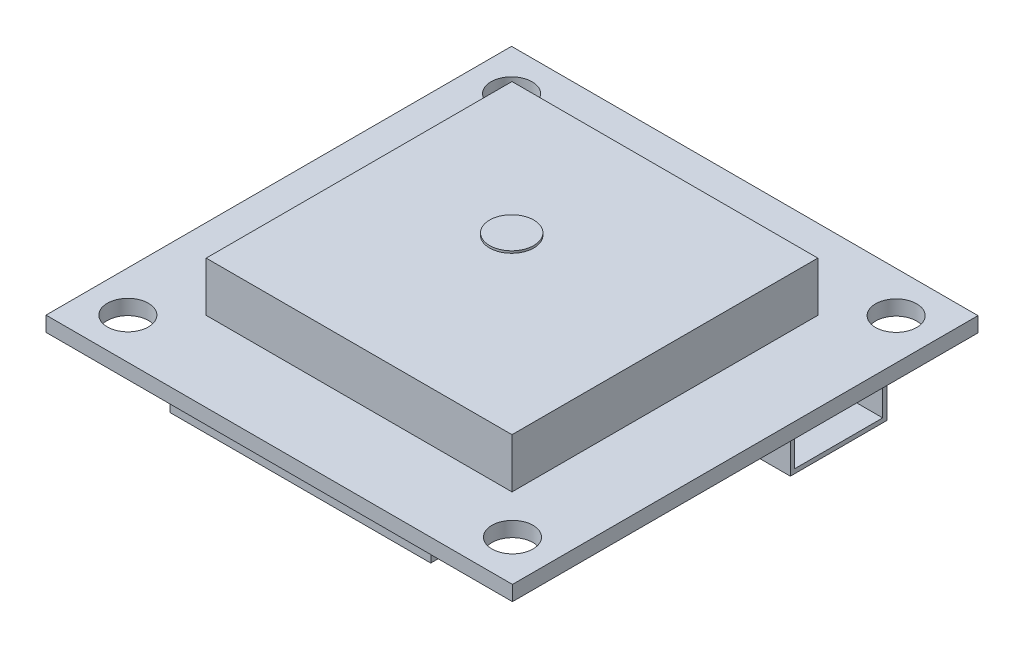
from build123d import *

# Parameters (mm, degrees)
SKETCH1_W           = 38.354
SKETCH1_H           = 38.2778
BOARD_DEPTH         = 1.2319
SKETCH3_W           = 25.146
SKETCH3_H           = 25.146
GPS_DEPTH           = 4.0767
SKETCH5_W           = 21.4376
SKETCH5_H           = 16.7894
UBLOCK_CHIP_DEPTH   = 2.4257
SKETCH6_R           = 3.3782
BATTERY_DEPTH       = 2.1082
SKETCH7_W           = 4.318
SKETCH7_H           = 7.9502
CONNECTOR_DEPTH     = 2.9972
SKETCH8_W           = 7.239
SKETCH8_H           = 2.286
CUT_EXTRUDE1_DEPTH  = 3.7592
CUT_EXTRUDE2_REACH  = 56.352
SKETCH9_R           = 1.6891
SKETCH10_R          = 1.8161
BOSS_EXTRUDE6_DEPTH = 0.1778
SKETCH11_W          = 22.479
SKETCH11_H          = 17.1323
BOSS_EXTRUDE7_DEPTH = 0.762


with BuildPart() as part:
    # Sketch1 → Board (new body)
    with BuildSketch(Plane(origin=(0, 0, 0), x_dir=(1, 0, 0), z_dir=(0, 1, 0))):
        with Locations((19.177, 19.1389)):
            Rectangle(SKETCH1_W, SKETCH1_H)
    extrude(amount=BOARD_DEPTH)

    # Sketch3 → GPS (add)
    with BuildSketch(Plane(origin=(0, 1.2319, 0), x_dir=(1, 0, 0), z_dir=(0, 1, 0))):
        with Locations((19.177, 19.1389)):
            Rectangle(SKETCH3_W, SKETCH3_H)
    extrude(amount=GPS_DEPTH)

    # Sketch5 → uBlock chip (add)
    with BuildSketch(Plane.XZ):
        with Locations((19.1008, -10.2108)):
            Rectangle(SKETCH5_W, SKETCH5_H)
    extrude(amount=UBLOCK_CHIP_DEPTH)

    # Sketch6 → Battery (add)
    with BuildSketch(Plane(origin=(0, 0, 0), x_dir=(-1, 0, 0), z_dir=(0, -1, 0))):
        with Locations(Location((-22.2758, 32.6263, 0), (0, 0, 90))):
            Circle(SKETCH6_R)
    extrude(amount=BATTERY_DEPTH)

    # Sketch7 → Connector (add)
    with BuildSketch(Plane(origin=(0, 0, 0), x_dir=(-1, 0, 0), z_dir=(0, -1, 0))):
        with Locations((-35.687, 27.3304)):
            Rectangle(SKETCH7_W, SKETCH7_H)
    extrude(amount=CONNECTOR_DEPTH)

    # Sketch8 → Cut-Extrude1 (cut)
    with BuildSketch(Plane(origin=(37.846, 0, 0), x_dir=(0, 0, -1), z_dir=(1, 0, 0))):
        with Locations((27.3304, -1.4986)):
            Rectangle(SKETCH8_W, SKETCH8_H)
    extrude(amount=-CUT_EXTRUDE1_DEPTH, mode=Mode.SUBTRACT)

    # Sketch9 → Cut-Extrude2 (cut, up to next)
    with BuildSketch(Plane(origin=(0, 1.2319, 0), x_dir=(1, 0, 0), z_dir=(0, 1, 0)), mode=Mode.PRIVATE) as cut_extrude2_sk1:
        with Locations(Location((34.9885, 3.3655, 0), (0, 0, 270))):
            Circle(SKETCH9_R)
    cut_extrude2_tool1 = extrude(cut_extrude2_sk1.sketch, amount=-CUT_EXTRUDE2_REACH, mode=Mode.PRIVATE) & part.part
    # Sketch9 → Cut-Extrude2 (cut, up to next)
    with BuildSketch(Plane(origin=(0, 1.2319, 0), x_dir=(1, 0, 0), z_dir=(0, 1, 0)), mode=Mode.PRIVATE) as cut_extrude2_sk2:
        with Locations(Location((3.3655, 3.3655, 0), (0, 0, 270))):
            Circle(SKETCH9_R)
    cut_extrude2_tool2 = extrude(cut_extrude2_sk2.sketch, amount=-CUT_EXTRUDE2_REACH, mode=Mode.PRIVATE) & part.part
    # Sketch9 → Cut-Extrude2 (cut, up to next)
    with BuildSketch(Plane(origin=(0, 1.2319, 0), x_dir=(1, 0, 0), z_dir=(0, 1, 0)), mode=Mode.PRIVATE) as cut_extrude2_sk3:
        with Locations(Location((3.3655, 34.9123, 0), (0, 0, 270))):
            Circle(SKETCH9_R)
    cut_extrude2_tool3 = extrude(cut_extrude2_sk3.sketch, amount=-CUT_EXTRUDE2_REACH, mode=Mode.PRIVATE) & part.part
    # Sketch9 → Cut-Extrude2 (cut, up to next)
    with BuildSketch(Plane(origin=(0, 1.2319, 0), x_dir=(1, 0, 0), z_dir=(0, 1, 0)), mode=Mode.PRIVATE) as cut_extrude2_sk4:
        with Locations(Location((34.9885, 34.9123, 0), (0, 0, 270))):
            Circle(SKETCH9_R)
    cut_extrude2_tool4 = extrude(cut_extrude2_sk4.sketch, amount=-CUT_EXTRUDE2_REACH, mode=Mode.PRIVATE) & part.part
    add(cut_extrude2_tool1.solids().sort_by_distance((34.9885, 1.2319, -3.3655))[0], mode=Mode.SUBTRACT)
    add(cut_extrude2_tool2.solids().sort_by_distance((3.3655, 1.2319, -3.3655))[0], mode=Mode.SUBTRACT)
    add(cut_extrude2_tool3.solids().sort_by_distance((3.3655, 1.2319, -34.9123))[0], mode=Mode.SUBTRACT)
    add(cut_extrude2_tool4.solids().sort_by_distance((34.9885, 1.2319, -34.9123))[0], mode=Mode.SUBTRACT)

    # Sketch10 → Boss-Extrude6 (add)
    with BuildSketch(Plane(origin=(0, 5.3086, 0), x_dir=(1, 0, 0), z_dir=(0, 1, 0))):
        with Locations(Location((17.5387, 20.7518, 0), (0, 0, 90))):
            Circle(SKETCH10_R)
    extrude(amount=BOSS_EXTRUDE6_DEPTH)

    # Sketch11 → Boss-Extrude7 (add)
    with BuildSketch(Plane.XZ):
        with Locations((19.1008, -10.2108)):
            Rectangle(SKETCH11_W, SKETCH11_H)
    extrude(amount=BOSS_EXTRUDE7_DEPTH)


solid = part.part
